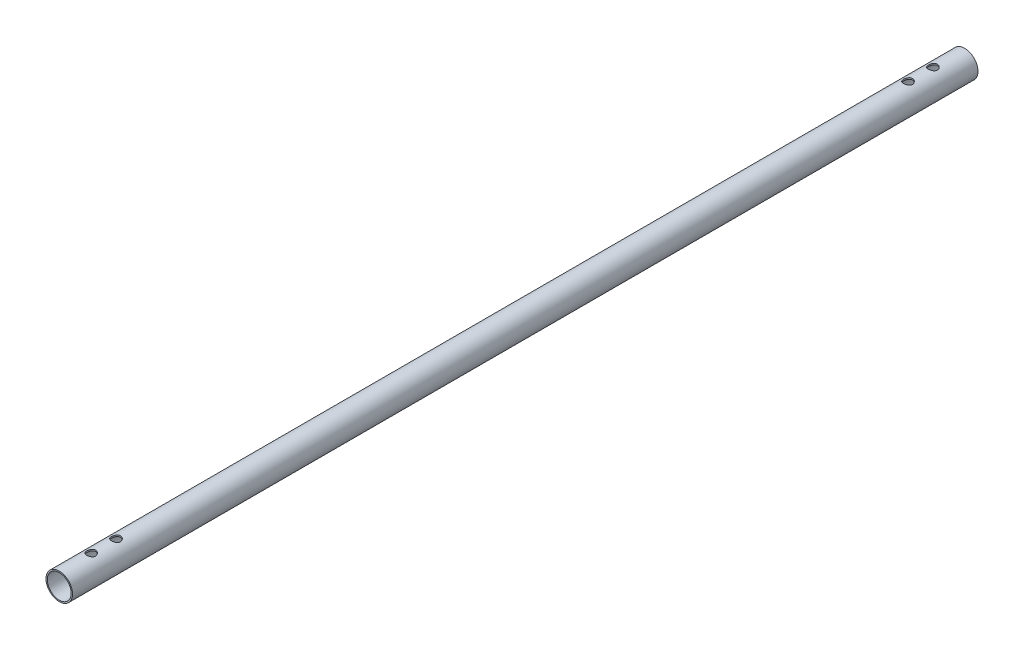
from build123d import *

# Parameters (mm, degrees)
SKETCH1_R               = 13.35
SKETCH1_R_2             = 11.7
BOSS_EXTRUDE1_DEPTH     = 910
SKETCH2_R               = 12
CUT_EXTRUDE1_DEPTH      = 77
CUT_EXTRUDE2_START      = -77
SKETCH3_R               = 12
CUT_EXTRUDE2_DEPTH      = 77
SKETCH4_R               = 4.5
CUT_EXTRUDE3_DEPTH      = 911.19582783
LPATTERN1_COUNT         = 2
LPATTERN1_PITCH         = 25
MIRROR1_COPY_1_SKETCH_R = 4.5
MIRROR1_COPY_1_DEPTH    = 911.19582783


with BuildPart() as part:
    # Sketch1 → Boss-Extrude1 (new body)
    with BuildSketch(Plane.XY):
        with Locations(Location((0, 0, 0), (0, 0, 180))):
            Circle(SKETCH1_R)
        with Locations(Location((0, 0, 0), (0, 0, 180))):
            Circle(SKETCH1_R_2, mode=Mode.SUBTRACT)
    extrude(amount=BOSS_EXTRUDE1_DEPTH)

    # Sketch2 → Cut-Extrude1 (cut)
    with BuildSketch(Plane.XY.offset(910)):
        Circle(SKETCH2_R)
    extrude(amount=-CUT_EXTRUDE1_DEPTH, mode=Mode.SUBTRACT)

    # Sketch3 → Cut-Extrude2 (cut)
    with BuildSketch(Plane(origin=(0, 0, 0), x_dir=(-1, 0, 0), z_dir=(0, 0, -1)).offset(CUT_EXTRUDE2_START)):
        with Locations(Location((0, 0, 0), (0, 0, 180))):
            Circle(SKETCH3_R)
    extrude(amount=CUT_EXTRUDE2_DEPTH, mode=Mode.SUBTRACT)

    # Sketch4 → Cut-Extrude3 (cut, symmetric)
    with BuildSketch(Plane(origin=(0, 0, 0), x_dir=(1, 0, 0), z_dir=(0, 1, 0))):
        with Locations(Location((0, -32, 0), (0, 0, 270))):
            Circle(SKETCH4_R)
    cut_extrude3 = extrude(amount=CUT_EXTRUDE3_DEPTH, both=True, mode=Mode.SUBTRACT)

    # LPattern1: Cut-Extrude3 ×2
    with Locations(*[(0, 0, i * LPATTERN1_PITCH) for i in range(1, LPATTERN1_COUNT)]):
        add(cut_extrude3, mode=Mode.SUBTRACT)

    # Mirror1: Cut-Extrude3 across plane
    add(cut_extrude3.mirror(Plane(origin=(0, 0, 455), x_dir=(1, 0, 0), z_dir=(0, 0, -1))), mode=Mode.SUBTRACT)

    # Mirror1 copy 1 sketch → Mirror1 copy 1 (cut, symmetric)
    with BuildSketch(Plane(origin=(0, 0, 885), x_dir=(1, 0, 0), z_dir=(0, 1, 0))):
        with Locations((0, 32)):
            Circle(MIRROR1_COPY_1_SKETCH_R)
    extrude(amount=MIRROR1_COPY_1_DEPTH, both=True, mode=Mode.SUBTRACT)


solid = part.part
